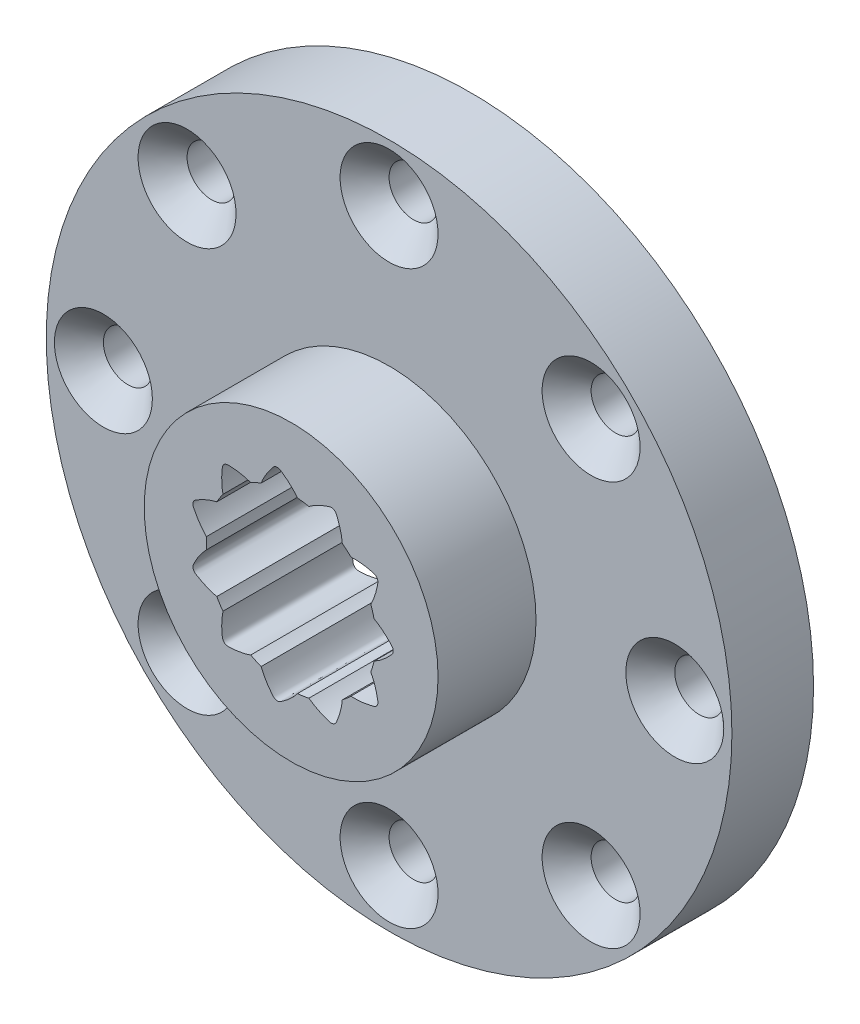
from build123d import *
from build123d.topology import SkipClean

# Parameters (mm, degrees)
SKETCH_431_W               = 25.399999618
SKETCH_431_H               = 13.849999792
CUT_EXTRUDE_551_DEPTH      = 12.699999809
PATTERN_CIRCULAR_609_COUNT = 11
SKETCH_2_R                 = 19.049999714
CUT_EXTRUDE_1_DEPTH        = 16.4
SKETCH_3_R                 = 19.049999714
SKETCH_3_R_2               = 14.5
CUT_EXTRUDE_3_DEPTH        = 29.404312714
CUT_EXTRUDE_START          = -5
SKETCH_4_R                 = 14.5
SKETCH_4_R_2               = 8
CUT_EXTRUDE_4_DEPTH        = 5
SKETCH_7_R                 = 14.5
CUT_EXTRUDE_6_DEPTH        = 1
SKETCH_9_R                 = 21
SKETCH_9_R_2               = 1.5
EXTRUDE_1_DEPTH            = 3
CUT_EXTRUDE_START_2        = -2.999999619
SKETCH_12_R                = 14.5
SKETCH_12_R_2              = 8
CUT_EXTRUDE_8_DEPTH        = 2.999999619
CUT_EXTRUDE_9_DEPTH        = 3
EXTRUDE_START              = 2
SKETCH_15_R                = 21
SKETCH_15_R_2              = 1.5
SKETCH_15_R_3              = 8
EXTRUDE_2_DEPTH            = 2
SKETCH_16_R                = 15
CUT_EXTRUDE_10_DEPTH       = 3
SKETCH_17_R                = 9
SKETCH_17_R_2              = 8
EXTRUDE_4_DEPTH            = 6
CHAMFER_1_SIZE             = 1.5


with BuildPart() as part:
    # Sketch 431 → Revolve 456 (revolve)
    with BuildSketch(Plane(origin=(0, 0, 0), x_dir=(0, 0, -1), z_dir=(1, 0, 0)), mode=Mode.PRIVATE) as revolve_456_sk:
        with Locations((0, 12.124999818)):
            Rectangle(SKETCH_431_W, SKETCH_431_H)
    revolve(revolve_456_sk.sketch.rotate(Axis((0, 0, 0), (0, 0, -1)), 90), axis=Axis((0, 0, 0), (0, 0, -1)))

    # Sketch 501 → Cut-Extrude 551 (cut, symmetric)
    with BuildSketch(Plane.XY):
        with BuildLine():
            ThreePointArc((4.469027925, -1.384752739), (4.678648388, 0), (4.469027925, 1.384752739))
            add(Edge.make_bspline(
                [(4.469027925, 1.384752739), (4.57663547, 1.352739149), (4.741342475, 1.292037756), (4.961277406, 1.188847506), (5.139472795, 1.091946871), (5.32325606, 0.977353109), (5.511199646, 0.844146143), (5.701349216, 0.691202763), (5.893414933, 0.518844474), (6.053805307, 0.349758145), (6.164800535, 0.236599337), (6.207916188, 0.17226004), (6.222327604, 0.145350903), (6.234338397, 0.117298049), (6.243761732, 0.088259992), (6.257035698, 0.030471683), (6.257035698, -0.030471683), (6.243761732, -0.088259992), (6.234338397, -0.117298049), (6.222327604, -0.145350903), (6.207916188, -0.17226004), (6.164800535, -0.236599337), (6.053805307, -0.349758145), (5.893414933, -0.518844474), (5.701349216, -0.691202763), (5.511199646, -0.844146143), (5.32325606, -0.977353109), (5.139472795, -1.091946871), (4.961277406, -1.188847506), (4.741342475, -1.292037756), (4.57663547, -1.352739149), (4.469027925, -1.384752739)],
                knots=[0, 0, 0, 0, 0.072254128, 0.112805384, 0.156306102, 0.202756282, 0.252155924, 0.304505028, 0.359803593, 0.41805162, 0.454758214, 0.461298748, 0.467839282, 0.474379816, 0.480920349, 0.487460883, 0.512539117, 0.519079651, 0.525620184, 0.532160718, 0.538701252, 0.545241786, 0.58194838, 0.640196407, 0.695494972, 0.747844076, 0.797243718, 0.843693898, 0.887194616, 0.927745872, 1, 1, 1, 1], degree=3))
        make_face()
    cut_extrude_551 = extrude(amount=CUT_EXTRUDE_551_DEPTH, both=True, mode=Mode.SUBTRACT)

    # Pattern Circular 609: Cut-Extrude 551 ×11 about axis
    pattern_circular_609_axis = Axis((0, 0, 55), (0, 0, -1))
    for i in range(1, PATTERN_CIRCULAR_609_COUNT):
        add(cut_extrude_551.rotate(pattern_circular_609_axis, i * 360 / PATTERN_CIRCULAR_609_COUNT), mode=Mode.SUBTRACT)

    # 草图2 → 切除-拉伸1 (cut)
    with BuildSketch(Plane(origin=(0, 0, -12.699999809), x_dir=(-1, 0, 0), z_dir=(0, 0, -1))):
        with Locations(Location((0, 0, 0), (0, 0, 180))):
            Circle(SKETCH_2_R)
    extrude(amount=-CUT_EXTRUDE_1_DEPTH, mode=Mode.SUBTRACT)

    # 草图3 → 切除-拉伸3 (cut, through all)
    with BuildSketch(Plane(origin=(0, 0, 3.700000191), x_dir=(-1, 0, 0), z_dir=(0, 0, -1))):
        Circle(SKETCH_3_R)
        Circle(SKETCH_3_R_2, mode=Mode.SUBTRACT)
    extrude(amount=-CUT_EXTRUDE_3_DEPTH, mode=Mode.SUBTRACT)

    # 草图4 → 切除-拉伸4 (cut)
    with BuildSketch(Plane.XY.offset(12.699999809).offset(CUT_EXTRUDE_START)):
        with Locations(Location((0, 0, 0), (0, 0, 180))):
            Circle(SKETCH_4_R)
        Circle(SKETCH_4_R_2, mode=Mode.SUBTRACT)
    extrude(amount=CUT_EXTRUDE_4_DEPTH, mode=Mode.SUBTRACT)

    # 草图7 → 切除-拉伸6 (cut)
    with BuildSketch(Plane(origin=(0, 0, 3.700000191), x_dir=(-1, 0, 0), z_dir=(0, 0, -1))):
        Circle(SKETCH_7_R)
    extrude(amount=-CUT_EXTRUDE_6_DEPTH, mode=Mode.SUBTRACT)

    # 草图9 → 凸台-拉伸1 (add)
    with BuildSketch(Plane(origin=(0, 0, 4.700000191), x_dir=(-1, 0, 0), z_dir=(0, 0, -1))):
        Circle(SKETCH_9_R)
        with Locations((0, 17.5)):
            Circle(SKETCH_9_R_2, mode=Mode.SUBTRACT)
        with Locations((12.374368671, 12.374368671)):
            Circle(SKETCH_9_R_2, mode=Mode.SUBTRACT)
        with Locations((17.5, 0)):
            Circle(SKETCH_9_R_2, mode=Mode.SUBTRACT)
        with Locations((12.374368671, -12.374368671)):
            Circle(SKETCH_9_R_2, mode=Mode.SUBTRACT)
        with Locations((0, -17.5)):
            Circle(SKETCH_9_R_2, mode=Mode.SUBTRACT)
        with Locations((-12.374368671, -12.374368671)):
            Circle(SKETCH_9_R_2, mode=Mode.SUBTRACT)
        with Locations((-17.5, 0)):
            Circle(SKETCH_9_R_2, mode=Mode.SUBTRACT)
        with Locations((-12.374368671, 12.374368671)):
            Circle(SKETCH_9_R_2, mode=Mode.SUBTRACT)
    extrude(amount=EXTRUDE_1_DEPTH)

    # 草图12 → 切除-拉伸8 (cut)
    with BuildSketch(Plane.XY.offset(7.699999809).offset(CUT_EXTRUDE_START_2)):
        Circle(SKETCH_12_R)
        Circle(SKETCH_12_R_2, mode=Mode.SUBTRACT)
    extrude(amount=CUT_EXTRUDE_8_DEPTH, mode=Mode.SUBTRACT)

    # 草图13 → 切除-拉伸9 (cut)
    with SkipClean():  # the faces are left unmerged after this step: merging them gives an invalid solid
        with BuildSketch(Plane.XY.offset(4.700000191)):
            with BuildLine():
                ThreePointArc((-4.55411156, -2.509993443), (-4.374518305, -2.811332209), (-4.175016657, -3.099876626))
                add(Edge.make_bspline(
                    [(-4.175016657, -3.099876626), (-4.179546286, -3.121529907), (-4.19796393, -3.214004782), (-4.224625566, -3.383018327), (-4.247031334, -3.612288624), (-4.255965926, -3.856150694), (-4.251482519, -4.114174955), (-4.228728955, -4.346117908), (-4.215895651, -4.504105765), (-4.195506003, -4.578823681), (-4.184606904, -4.607336839), (-4.171271369, -4.634784704), (-4.155496842, -4.660922268), (-4.120515951, -4.708797357), (-4.074458028, -4.748706775), (-4.022091939, -4.776518274), (-3.993975468, -4.788412476), (-3.964909139, -4.797706037), (-3.935135099, -4.804436352), (-3.858275955, -4.813984996), (-3.700069817, -4.804203659), (-3.467249539, -4.7937167), (-3.211213538, -4.761433792), (-2.971105157, -4.71788495), (-2.747357174, -4.663078676), (-2.58385829, -4.612635281), (-2.49494578, -4.581244555), (-2.474157532, -4.573679448)],
                    knots=[0.142066879, 0.142066879, 0.142066879, 0.142066879, 0.156306102, 0.202756282, 0.252155924, 0.304505028, 0.359803593, 0.41805162, 0.454758214, 0.461298748, 0.467839282, 0.474379816, 0.480920349, 0.487460883, 0.512539117, 0.519079651, 0.525620184, 0.532160718, 0.538701252, 0.545241786, 0.58194838, 0.640196407, 0.695494972, 0.747844076, 0.797243718, 0.843693898, 0.857933121, 0.857933121, 0.857933121, 0.857933121], degree=3))
                ThreePointArc((-2.474157532, -4.573679448), (-2.160158035, -4.730086305), (-1.836327679, -4.864966582))
                add(Edge.make_bspline(
                    [(-1.836327679, -4.864966582), (-1.828431598, -4.885631383), (-1.793929814, -4.973383528), (-1.724983389, -5.129981139), (-1.619879439, -5.334969059), (-1.495553907, -5.544949292), (-1.352283778, -5.759589199), (-1.207744434, -5.942410524), (-1.111533688, -6.068380158), (-1.053985269, -6.120213392), (-1.029400987, -6.13830769), (-1.003342985, -6.154188569), (-0.975941574, -6.167648534), (-0.920630549, -6.189011524), (-0.860307498, -6.197684669), (-0.801218309, -6.192769947), (-0.771134737, -6.187575074), (-0.741658107, -6.179678871), (-0.712971908, -6.169243712), (-0.643151494, -6.135723351), (-0.515348212, -6.041962071), (-0.325157008, -5.907267734), (-0.127219276, -5.741686111), (0.051228466, -5.575238102), (0.209826738, -5.408164838), (0.320098994, -5.277334984), (0.377925849, -5.202857693), (0.391324031, -5.185254544)],
                    knots=[0.142066879, 0.142066879, 0.142066879, 0.142066879, 0.156306102, 0.202756282, 0.252155924, 0.304505028, 0.359803593, 0.41805162, 0.454758214, 0.461298748, 0.467839282, 0.474379816, 0.480920349, 0.487460883, 0.512539117, 0.519079651, 0.525620184, 0.532160718, 0.538701252, 0.545241786, 0.58194838, 0.640196407, 0.695494972, 0.747844076, 0.797243718, 0.843693898, 0.857933121, 0.857933121, 0.857933121, 0.857933121], degree=3))
                ThreePointArc((0.391324031, -5.185254544), (0.740037148, -5.14707142), (1.085382362, -5.085464022))
                add(Edge.make_bspline(
                    [(1.085382362, -5.085464022), (1.103197204, -5.098579415), (1.179664342, -5.153748144), (1.322328827, -5.248211186), (1.521572732, -5.363834512), (1.73968591, -5.473265668), (1.976255507, -5.576374569), (2.196690411, -5.652029785), (2.345732367, -5.705986728), (2.42216834, -5.718478595), (2.452632471, -5.720409221), (2.483139708, -5.719681046), (2.513468249, -5.716189969), (2.571548548, -5.704258262), (2.626984584, -5.678941472), (2.674036474, -5.642860917), (2.696535825, -5.622226305), (2.717064134, -5.599647327), (2.735554827, -5.575359782), (2.776169021, -5.509412895), (2.832992809, -5.361440216), (2.920170575, -5.145303001), (2.997166207, -4.898993658), (3.057297413, -4.66249255), (3.100392144, -4.436196877), (3.12242711, -4.266518117), (3.130808692, -4.172600275), (3.132562979, -4.15054796)],
                    knots=[0.142066879, 0.142066879, 0.142066879, 0.142066879, 0.156306102, 0.202756282, 0.252155924, 0.304505028, 0.359803593, 0.41805162, 0.454758214, 0.461298748, 0.467839282, 0.474379816, 0.480920349, 0.487460883, 0.512539117, 0.519079651, 0.525620184, 0.532160718, 0.538701252, 0.545241786, 0.58194838, 0.640196407, 0.695494972, 0.747844076, 0.797243718, 0.843693898, 0.857933121, 0.857933121, 0.857933121, 0.857933121], degree=3))
                ThreePointArc((3.132562979, -4.15054796), (3.405275765, -3.929897728), (3.662491172, -3.691362567))
                add(Edge.make_bspline(
                    [(3.662491172, -3.691362567), (3.684568688, -3.692764507), (3.778723405, -3.69783414), (3.949810983, -3.700171263), (4.179936312, -3.689720407), (4.422587743, -3.663858867), (4.677347633, -3.622700413), (4.903691572, -3.567169525), (5.05824497, -3.531982829), (5.129300616, -3.501167249), (5.155972448, -3.486321242), (5.181243088, -3.469215205), (5.204869661, -3.449881477), (5.24727915, -3.408443306), (5.280227622, -3.357174483), (5.300303569, -3.301383417), (5.308075315, -3.271860409), (5.31313771, -3.241767322), (5.315562233, -3.211338516), (5.314075488, -3.133902773), (5.281878631, -2.978698975), (5.238364633, -2.749740921), (5.169972596, -2.500905334), (5.092696033, -2.269438557), (5.00660495, -2.055767752), (4.933406679, -1.901111894), (4.889681896, -1.817571752), (4.879235315, -1.798071724)],
                    knots=[0.142066879, 0.142066879, 0.142066879, 0.142066879, 0.156306102, 0.202756282, 0.252155924, 0.304505028, 0.359803593, 0.41805162, 0.454758214, 0.461298748, 0.467839282, 0.474379816, 0.480920349, 0.487460883, 0.512539117, 0.519079651, 0.525620184, 0.532160718, 0.538701252, 0.545241786, 0.58194838, 0.640196407, 0.695494972, 0.747844076, 0.797243718, 0.843693898, 0.857933121, 0.857933121, 0.857933121, 0.857933121], degree=3))
                ThreePointArc((4.879235315, -1.798071724), (4.989363388, -1.465009274), (5.076784913, -1.125279579))
                add(Edge.make_bspline(
                    [(5.076784913, -1.125279579), (5.096115647, -1.11452296), (5.178064486, -1.067883923), (5.32325606, -0.977353109), (5.511199646, -0.844146143), (5.701349216, -0.691202763), (5.893414933, -0.518844474), (6.053805307, -0.349758145), (6.164800535, -0.236599337), (6.207916188, -0.17226004), (6.222327604, -0.145350903), (6.234338397, -0.117298049), (6.243761732, -0.088259992), (6.257035698, -0.030471683), (6.257035698, 0.030471683), (6.243761732, 0.088259992), (6.234338397, 0.117298049), (6.222327604, 0.145350903), (6.207916188, 0.17226004), (6.164800535, 0.236599337), (6.053805307, 0.349758145), (5.893414933, 0.518844474), (5.701349216, 0.691202763), (5.511199646, 0.844146143), (5.32325606, 0.977353109), (5.178064486, 1.067883923), (5.096115647, 1.11452296), (5.076784913, 1.125279579)],
                    knots=[0.142066879, 0.142066879, 0.142066879, 0.142066879, 0.156306102, 0.202756282, 0.252155924, 0.304505028, 0.359803593, 0.41805162, 0.454758214, 0.461298748, 0.467839282, 0.474379816, 0.480920349, 0.487460883, 0.512539117, 0.519079651, 0.525620184, 0.532160718, 0.538701252, 0.545241786, 0.58194838, 0.640196407, 0.695494972, 0.747844076, 0.797243718, 0.843693898, 0.857933121, 0.857933121, 0.857933121, 0.857933121], degree=3))
                ThreePointArc((5.076784913, 1.125279579), (4.989363388, 1.465009274), (4.879235315, 1.798071724))
                add(Edge.make_bspline(
                    [(4.879235315, 1.798071724), (4.889681896, 1.817571752), (4.933406679, 1.901111894), (5.00660495, 2.055767752), (5.092696033, 2.269438557), (5.169972596, 2.500905334), (5.238364633, 2.749740921), (5.281878631, 2.978698975), (5.314075488, 3.133902773), (5.315562233, 3.211338516), (5.31313771, 3.241767322), (5.308075315, 3.271860409), (5.300303569, 3.301383417), (5.280227622, 3.357174483), (5.24727915, 3.408443306), (5.204869661, 3.449881477), (5.181243088, 3.469215205), (5.155972448, 3.486321242), (5.129300616, 3.501167249), (5.05824497, 3.531982829), (4.903691572, 3.567169525), (4.677347633, 3.622700413), (4.422587743, 3.663858867), (4.179936312, 3.689720407), (3.949810983, 3.700171263), (3.778723405, 3.69783414), (3.684568688, 3.692764507), (3.662491172, 3.691362567)],
                    knots=[0.142066879, 0.142066879, 0.142066879, 0.142066879, 0.156306102, 0.202756282, 0.252155924, 0.304505028, 0.359803593, 0.41805162, 0.454758214, 0.461298748, 0.467839282, 0.474379816, 0.480920349, 0.487460883, 0.512539117, 0.519079651, 0.525620184, 0.532160718, 0.538701252, 0.545241786, 0.58194838, 0.640196407, 0.695494972, 0.747844076, 0.797243718, 0.843693898, 0.857933121, 0.857933121, 0.857933121, 0.857933121], degree=3))
                ThreePointArc((3.662491172, 3.691362567), (3.405275765, 3.929897728), (3.132562979, 4.15054796))
                add(Edge.make_bspline(
                    [(3.132562979, 4.15054796), (3.130808692, 4.172600275), (3.12242711, 4.266518117), (3.100392144, 4.436196877), (3.057297413, 4.66249255), (2.997166207, 4.898993658), (2.920170575, 5.145303001), (2.832992809, 5.361440216), (2.776169021, 5.509412895), (2.735554827, 5.575359782), (2.717064134, 5.599647327), (2.696535825, 5.622226305), (2.674036474, 5.642860917), (2.626984584, 5.678941472), (2.571548548, 5.704258262), (2.513468249, 5.716189969), (2.483139708, 5.719681046), (2.452632471, 5.720409221), (2.42216834, 5.718478595), (2.345732367, 5.705986728), (2.196690411, 5.652029785), (1.976255507, 5.576374569), (1.73968591, 5.473265668), (1.521572732, 5.363834512), (1.322328827, 5.248211186), (1.179664342, 5.153748144), (1.103197204, 5.098579415), (1.085382362, 5.085464022)],
                    knots=[0.142066879, 0.142066879, 0.142066879, 0.142066879, 0.156306102, 0.202756282, 0.252155924, 0.304505028, 0.359803593, 0.41805162, 0.454758214, 0.461298748, 0.467839282, 0.474379816, 0.480920349, 0.487460883, 0.512539117, 0.519079651, 0.525620184, 0.532160718, 0.538701252, 0.545241786, 0.58194838, 0.640196407, 0.695494972, 0.747844076, 0.797243718, 0.843693898, 0.857933121, 0.857933121, 0.857933121, 0.857933121], degree=3))
                ThreePointArc((1.085382362, 5.085464022), (0.740037148, 5.14707142), (0.391324031, 5.185254544))
                add(Edge.make_bspline(
                    [(0.391324031, 5.185254544), (0.377925849, 5.202857693), (0.320098994, 5.277334984), (0.209826738, 5.408164838), (0.051228466, 5.575238102), (-0.127219276, 5.741686111), (-0.325157008, 5.907267734), (-0.515348212, 6.041962071), (-0.643151494, 6.135723351), (-0.712971908, 6.169243712), (-0.741658107, 6.179678871), (-0.771134737, 6.187575074), (-0.801218309, 6.192769947), (-0.860307498, 6.197684669), (-0.920630549, 6.189011524), (-0.975941574, 6.167648534), (-1.003342985, 6.154188569), (-1.029400987, 6.13830769), (-1.053985269, 6.120213392), (-1.111533688, 6.068380158), (-1.207744434, 5.942410524), (-1.352283778, 5.759589199), (-1.495553907, 5.544949292), (-1.619879439, 5.334969059), (-1.724983389, 5.129981139), (-1.793929814, 4.973383528), (-1.828431598, 4.885631383), (-1.836327679, 4.864966582)],
                    knots=[0.142066879, 0.142066879, 0.142066879, 0.142066879, 0.156306102, 0.202756282, 0.252155924, 0.304505028, 0.359803593, 0.41805162, 0.454758214, 0.461298748, 0.467839282, 0.474379816, 0.480920349, 0.487460883, 0.512539117, 0.519079651, 0.525620184, 0.532160718, 0.538701252, 0.545241786, 0.58194838, 0.640196407, 0.695494972, 0.747844076, 0.797243718, 0.843693898, 0.857933121, 0.857933121, 0.857933121, 0.857933121], degree=3))
                ThreePointArc((-1.836327679, 4.864966582), (-2.160158035, 4.730086305), (-2.474157532, 4.573679448))
                add(Edge.make_bspline(
                    [(-2.474157532, 4.573679448), (-2.49494578, 4.581244555), (-2.58385829, 4.612635281), (-2.747357174, 4.663078676), (-2.971105157, 4.71788495), (-3.211213538, 4.761433792), (-3.467249539, 4.7937167), (-3.700069817, 4.804203659), (-3.858275955, 4.813984996), (-3.935135099, 4.804436352), (-3.964909139, 4.797706037), (-3.993975468, 4.788412476), (-4.022091939, 4.776518274), (-4.074458028, 4.748706775), (-4.120515951, 4.708797357), (-4.155496842, 4.660922268), (-4.171271369, 4.634784704), (-4.184606904, 4.607336839), (-4.195506003, 4.578823681), (-4.215895651, 4.504105765), (-4.228728955, 4.346117908), (-4.251482519, 4.114174955), (-4.255965926, 3.856150694), (-4.247031334, 3.612288624), (-4.224625566, 3.383018327), (-4.19796393, 3.214004782), (-4.179546286, 3.121529907), (-4.175016657, 3.099876626)],
                    knots=[0.142066879, 0.142066879, 0.142066879, 0.142066879, 0.156306102, 0.202756282, 0.252155924, 0.304505028, 0.359803593, 0.41805162, 0.454758214, 0.461298748, 0.467839282, 0.474379816, 0.480920349, 0.487460883, 0.512539117, 0.519079651, 0.525620184, 0.532160718, 0.538701252, 0.545241786, 0.58194838, 0.640196407, 0.695494972, 0.747844076, 0.797243718, 0.843693898, 0.857933121, 0.857933121, 0.857933121, 0.857933121], degree=3))
                ThreePointArc((-4.175016657, 3.099876626), (-4.374518305, 2.811332209), (-4.55411156, 2.509993443))
                add(Edge.make_bspline(
                    [(-4.55411156, 2.509993443), (-4.575689753, 2.50511864), (-4.667458824, 2.483456468), (-4.832274596, 2.437497981), (-5.050133886, 2.362636661), (-5.275670191, 2.269459887), (-5.508514839, 2.158194484), (-5.710045399, 2.04114453), (-5.848425061, 1.963840418), (-5.907920702, 1.914254398), (-5.929329534, 1.892495435), (-5.948757208, 1.868962751), (-5.965979798, 1.843755799), (-5.994996923, 1.792048032), (-6.012166653, 1.733573299), (-6.015711224, 1.674386115), (-6.014850566, 1.643869443), (-6.011229697, 1.613569095), (-6.004983224, 1.583689803), (-5.981740533, 1.509809616), (-5.907121912, 1.369963565), (-5.800865599, 1.162539231), (-5.665138834, 0.943051497), (-5.525780788, 0.742732075), (-5.382978976, 0.5619711), (-5.26917416, 0.434202227), (-5.203684559, 0.366364742), (-5.188167346, 0.350597745)],
                    knots=[0.142066879, 0.142066879, 0.142066879, 0.142066879, 0.156306102, 0.202756282, 0.252155924, 0.304505028, 0.359803593, 0.41805162, 0.454758214, 0.461298748, 0.467839282, 0.474379816, 0.480920349, 0.487460883, 0.512539117, 0.519079651, 0.525620184, 0.532160718, 0.538701252, 0.545241786, 0.58194838, 0.640196407, 0.695494972, 0.747844076, 0.797243718, 0.843693898, 0.857933121, 0.857933121, 0.857933121, 0.857933121], degree=3))
                ThreePointArc((-5.188167346, 0.350597745), (-5.199999922, 0), (-5.188167346, -0.350597745))
                add(Edge.make_bspline(
                    [(-5.188167346, -0.350597745), (-5.203684559, -0.366364742), (-5.26917416, -0.434202227), (-5.382978976, -0.5619711), (-5.525780788, -0.742732075), (-5.665138834, -0.943051497), (-5.800865599, -1.162539231), (-5.907121912, -1.369963565), (-5.981740533, -1.509809616), (-6.004983224, -1.583689803), (-6.011229697, -1.613569095), (-6.014850566, -1.643869443), (-6.015711224, -1.674386115), (-6.012166653, -1.733573299), (-5.994996923, -1.792048032), (-5.965979798, -1.843755799), (-5.948757208, -1.868962751), (-5.929329534, -1.892495435), (-5.907920702, -1.914254398), (-5.848425061, -1.963840418), (-5.710045399, -2.04114453), (-5.508514839, -2.158194484), (-5.275670191, -2.269459887), (-5.050133886, -2.362636661), (-4.832274596, -2.437497981), (-4.667458824, -2.483456468), (-4.575689753, -2.50511864), (-4.55411156, -2.509993443)],
                    knots=[0.142066879, 0.142066879, 0.142066879, 0.142066879, 0.156306102, 0.202756282, 0.252155924, 0.304505028, 0.359803593, 0.41805162, 0.454758214, 0.461298748, 0.467839282, 0.474379816, 0.480920349, 0.487460883, 0.512539117, 0.519079651, 0.525620184, 0.532160718, 0.538701252, 0.545241786, 0.58194838, 0.640196407, 0.695494972, 0.747844076, 0.797243718, 0.843693898, 0.857933121, 0.857933121, 0.857933121, 0.857933121], degree=3))
            make_face()
        extrude(amount=-CUT_EXTRUDE_9_DEPTH, mode=Mode.SUBTRACT)

    # 草图15 → 凸台-拉伸2 (add)
    with BuildSketch(Plane.XY.offset(4.700000191).offset(EXTRUDE_START)):
        Circle(SKETCH_15_R)
        with Locations((12.374368671, 12.374368671)):
            Circle(SKETCH_15_R_2, mode=Mode.SUBTRACT)
        with Locations((17.5, 0)):
            Circle(SKETCH_15_R_2, mode=Mode.SUBTRACT)
        with Locations((12.374368671, -12.374368671)):
            Circle(SKETCH_15_R_2, mode=Mode.SUBTRACT)
        with Locations((0, -17.5)):
            Circle(SKETCH_15_R_2, mode=Mode.SUBTRACT)
        with Locations((-12.374368671, -12.374368671)):
            Circle(SKETCH_15_R_2, mode=Mode.SUBTRACT)
        with Locations((-17.5, 0)):
            Circle(SKETCH_15_R_2, mode=Mode.SUBTRACT)
        with Locations((-12.374368671, 12.374368671)):
            Circle(SKETCH_15_R_2, mode=Mode.SUBTRACT)
        with Locations((0, 17.5)):
            Circle(SKETCH_15_R_2, mode=Mode.SUBTRACT)
        Circle(SKETCH_15_R_3, mode=Mode.SUBTRACT)
    extrude(amount=-EXTRUDE_2_DEPTH)

    # 草图16 → 切除-拉伸10 (cut)
    with BuildSketch(Plane(origin=(0, 0, 1.700000191), x_dir=(-1, 0, 0), z_dir=(0, 0, -1))):
        Circle(SKETCH_16_R)
    extrude(amount=-CUT_EXTRUDE_10_DEPTH, mode=Mode.SUBTRACT)

    # 草图17 → 凸台-拉伸4 (add)
    with BuildSketch(Plane.XY.offset(6.700000191)):
        Circle(SKETCH_17_R)
        Circle(SKETCH_17_R_2, mode=Mode.SUBTRACT)
    extrude(amount=EXTRUDE_4_DEPTH)

    # 倒角1
    chamfer_1_edges = [part.edges().sort_by_distance(p)[0] for p in [
        (10.874368671, 12.374368671, 6.700000191),
        (16, 0, 6.700000191),
        (10.874368671, -12.374368671, 6.700000191),
        (-1.5, -17.5, 6.700000191),
        (-13.874368671, -12.374368671, 6.700000191),
        (-19, 0, 6.700000191),
        (-13.874368671, 12.374368671, 6.700000191),
        (-1.5, 17.5, 6.700000191),
    ]]
    chamfer(chamfer_1_edges, length=CHAMFER_1_SIZE)


solid = part.part
